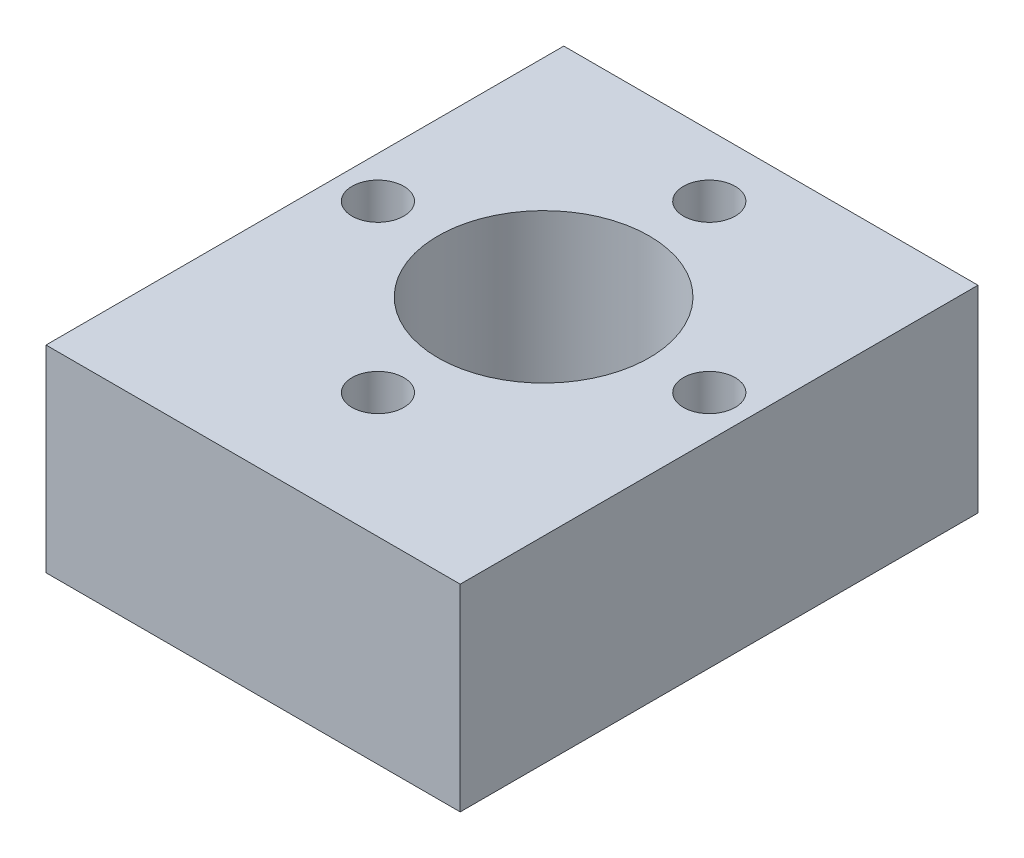
from build123d import *

# Parameters (mm, degrees)
SKETCH1_W                       = 20
SKETCH1_H                       = 25
SKETCH1_R                       = 5.1
BOSS_EXTRUDE1_DEPTH             = 9.525
TAP_DRILL_FOR_M3X0_5_TAP1_D     = 2.5
TAP_DRILL_FOR_M3X0_5_TAP3_D     = 2.5
TAP_DRILL_FOR_M3X0_5_TAP3_DEPTH = 6
TAP_DRILL_FOR_M3X0_5_TAP3_TIP   = 0.751075774


with BuildPart() as part:
    # Sketch1 → Boss-Extrude1 (new body)
    with BuildSketch(Plane(origin=(0, 0, 0), x_dir=(1, 0, 0), z_dir=(0, 1, 0))):
        Rectangle(SKETCH1_W, SKETCH1_H)
        with Locations(Location((0, 1.5261946, 0), (0, 0, 90))):
            Circle(SKETCH1_R, mode=Mode.SUBTRACT)
    extrude(amount=BOSS_EXTRUDE1_DEPTH)

    # Tap Drill for M3x0.5 Tap1 (through all)
    with Locations(Plane(origin=(0, 9.525, 0), x_dir=(1, 0, 0), z_dir=(0, 1, 0))):
        with Locations((-8, 1.5261946), (0, 9.5261946), (8, 1.5261946), (0, -6.4738054)):
            Hole(TAP_DRILL_FOR_M3X0_5_TAP1_D / 2)

    # Tap Drill for M3x0.5 Tap3
    with Locations(Plane(origin=(0, 0, -12.5), x_dir=(-1, 0, 0), z_dir=(0, 0, -1))):
        with Locations((-7, 4.7625), (7, 4.7625)):
            Hole(TAP_DRILL_FOR_M3X0_5_TAP3_D / 2, depth=TAP_DRILL_FOR_M3X0_5_TAP3_DEPTH)
            with Locations((0, 0, -(TAP_DRILL_FOR_M3X0_5_TAP3_DEPTH + TAP_DRILL_FOR_M3X0_5_TAP3_TIP / 2))):  # 118° drill point
                Cone(0, TAP_DRILL_FOR_M3X0_5_TAP3_D / 2, TAP_DRILL_FOR_M3X0_5_TAP3_TIP, mode=Mode.SUBTRACT)


solid = part.part
